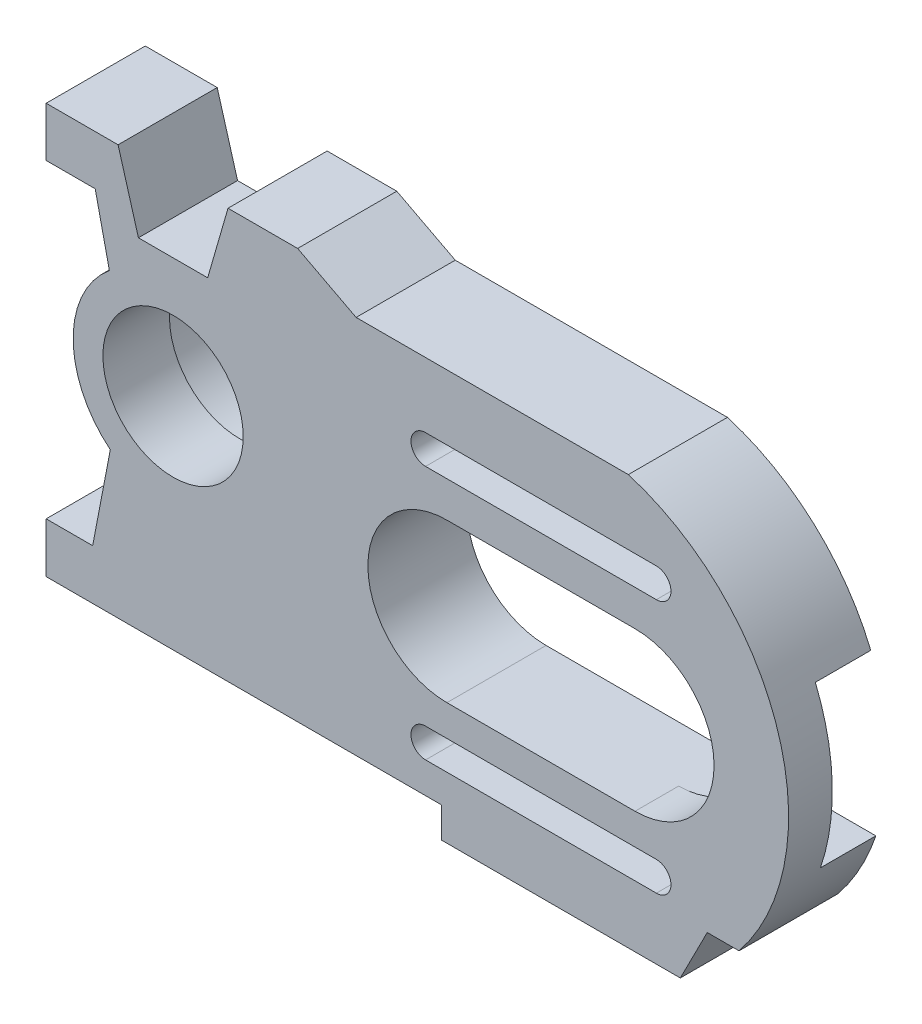
from build123d import *

# Parameters (mm, degrees)
SKETCH1_R           = 7.0231
SKETCH1_R_2         = 7.0104
BOSS_EXTRUDE2_DEPTH = 9.906
SKETCH2_R           = 9.9822
SKETCH2_R_2         = 4.98475
BOSS_EXTRUDE3_DEPTH = 1.9812
SKETCH4_R           = 9.9822
SKETCH4_R_2         = 7.0231
BOSS_EXTRUDE4_DEPTH = 9.906
SKETCH5_R           = 8.0264
CUT_EXTRUDE1_DEPTH  = 5.2324
CUT_EXTRUDE2_DEPTH  = 5.5372
SKETCH7_R           = 1.9685
CUT_EXTRUDE3_DEPTH  = 12.7
CUT_EXTRUDE4_DEPTH  = 4.064


with BuildPart() as part:
    # Sketch1 → Boss-Extrude2 (new body)
    # profile 1 of 2: a face of its own
    with BuildSketch(Plane.XY):
        with BuildLine():
            Line((-7.77875, 14.0589), (-5.59435, 4.245842871))
            ThreePointArc((-5.59435, 4.245842871), (2.239894431, 6.65633582), (7.0231, 0))
            ThreePointArc((7.0231, 0), (2.239894431, -6.65633582), (-5.59435, -4.245842871))
            Line((-5.59435, -4.245842871), (-8.03275, -16.9545))
            Line((-8.03275, -16.9545), (-12.68095, -16.9545))
            Line((-12.68095, -16.9545), (-12.68095, -21.9583))
            Line((-12.68095, -21.9583), (26.84145, -21.9583))
            Line((26.84145, -21.9583), (26.84145, -25.0063))
            Line((26.84145, -25.0063), (50.69205, -25.0063))
            Line((50.69205, -25.0063), (53.38445, -19.7231))
            Line((53.38445, -19.7231), (56.55945, -19.7231))
            ThreePointArc((56.55945, -19.7231), (60.50132397, 1.056607323), (45.49775, 15.9639))
            Line((45.49775, 15.9639), (18.29435, 15.9639))
            Line((18.29435, 15.9639), (12.45235, 19.0119))
            Line((12.45235, 19.0119), (5.49275, 19.0119))
            Line((5.49275, 19.0119), (3.460028891, 11.9761))
            Line((3.460028891, 11.9761), (-3.460028891, 11.9761))
            Line((-3.460028891, 11.9761), (-5.49275, 19.0119))
            Line((-5.49275, 19.0119), (-12.68095, 19.0119))
            Line((-12.68095, 19.0119), (-12.68095, 14.0589))
            Line((-12.68095, 14.0589), (-7.77875, 14.0589))
        make_face()
        with BuildLine():
            ThreePointArc((25.235083599, -18.8595), (23.774583599, -17.399), (25.235083599, -15.9385))
            Line((25.235083599, -15.9385), (48.298283599, -15.9385))
            ThreePointArc((48.298283599, -15.9385), (49.758783599, -17.399), (48.298283599, -18.8595))
            Line((48.298283599, -18.8595), (25.235083599, -18.8595))
        make_face(mode=Mode.SUBTRACT)
        with BuildLine():
            ThreePointArc((27.368683599, -12.8397), (19.469283599, -4.9403), (27.368683599, 2.9591))
            Line((27.368683599, 2.9591), (46.164683599, 2.9591))
            ThreePointArc((46.164683599, 2.9591), (54.064083599, -4.9403), (46.164683599, -12.8397))
            Line((46.164683599, -12.8397), (27.368683599, -12.8397))
        make_face(mode=Mode.SUBTRACT)
        with BuildLine():
            ThreePointArc((25.235083599, 6.5405), (23.774583599, 8.001), (25.235083599, 9.4615))
            Line((25.235083599, 9.4615), (48.298283599, 9.4615))
            ThreePointArc((48.298283599, 9.4615), (49.758783599, 8.001), (48.298283599, 6.5405))
            Line((48.298283599, 6.5405), (25.235083599, 6.5405))
        make_face(mode=Mode.SUBTRACT)
    # profile 2 of 2: a face of its own
    with BuildSketch(Plane.XY):
        Circle(SKETCH1_R)
        Circle(SKETCH1_R_2, mode=Mode.SUBTRACT)
    extrude(amount=BOSS_EXTRUDE2_DEPTH)

    # Sketch2 → Boss-Extrude3 (add)
    with BuildSketch(Plane(origin=(0, 0, 0), x_dir=(-1, 0, 0), z_dir=(0, 0, -1))):
        with Locations(Location((0, 0, 0), (0, 0, 308.91150739))):
            Circle(SKETCH2_R)
        Circle(SKETCH2_R_2, mode=Mode.SUBTRACT)
    extrude(amount=BOSS_EXTRUDE3_DEPTH)

    # Sketch4 → Boss-Extrude4 (add)
    with BuildSketch(Plane.XY):
        with Locations(Location((0, 0, 0), (0, 0, 231.08849261))):
            Circle(SKETCH4_R)
        Circle(SKETCH4_R_2, mode=Mode.SUBTRACT)
    extrude(amount=BOSS_EXTRUDE4_DEPTH)

    # Sketch5 → Cut-Extrude1 (cut)
    with BuildSketch(Plane(origin=(0, 0, -1.9812), x_dir=(-1, 0, 0), z_dir=(0, 0, -1))):
        Circle(SKETCH5_R)
    extrude(amount=-CUT_EXTRUDE1_DEPTH, mode=Mode.SUBTRACT)

    # Sketch6 → Cut-Extrude2 (cut)
    with BuildSketch(Plane(origin=(0, 0, 0), x_dir=(-1, 0, 0), z_dir=(0, 0, -1))):
        with BuildLine():
            Line((-46.164683599, 2.9591), (-59.816731187, 2.9591))
            ThreePointArc((-59.816731187, 2.9591), (-61.500748438, -4.894234845), (-60.325858759, -12.8397))
            Line((-60.325858759, -12.8397), (-46.164683599, -12.8397))
            Line((-46.164683599, -12.8397), (-46.164683599, 2.9591))
        make_face()
    extrude(amount=-CUT_EXTRUDE2_DEPTH, mode=Mode.SUBTRACT)

    # Sketch7 → Cut-Extrude3 (cut)
    with BuildSketch(Plane.XZ.offset(21.9583)):
        with Locations(Location((-8.93445, 4.953, 0), (0, 0, 270))):
            Circle(SKETCH7_R)
        with Locations(Location((17.43075, 4.953, 0), (0, 0, 270))):
            Circle(SKETCH7_R)
    extrude(amount=-CUT_EXTRUDE3_DEPTH, mode=Mode.SUBTRACT)

    # Sketch8 → Cut-Extrude4 (cut)
    with BuildSketch(Plane(origin=(0, 0, 0), x_dir=(-1, 0, 0), z_dir=(0, 0, -1))):
        with BuildLine():
            Line((-48.298283599, 11.303), (-25.235083599, 11.303))
            ThreePointArc((-25.235083599, 11.303), (-21.933083599, 8.001), (-25.235083599, 4.699))
            Line((-25.235083599, 4.699), (-48.298283599, 4.699))
            ThreePointArc((-48.298283599, 4.699), (-51.600283599, 8.001), (-48.298283599, 11.303))
        make_face()
        with BuildLine():
            Line((-48.298283599, -14.097), (-25.235083599, -14.097))
            ThreePointArc((-25.235083599, -14.097), (-21.933083599, -17.399), (-25.235083599, -20.701))
            Line((-25.235083599, -20.701), (-48.298283599, -20.701))
            ThreePointArc((-48.298283599, -20.701), (-51.600283599, -17.399), (-48.298283599, -14.097))
        make_face()
    extrude(amount=-CUT_EXTRUDE4_DEPTH, mode=Mode.SUBTRACT)


solid = part.part
